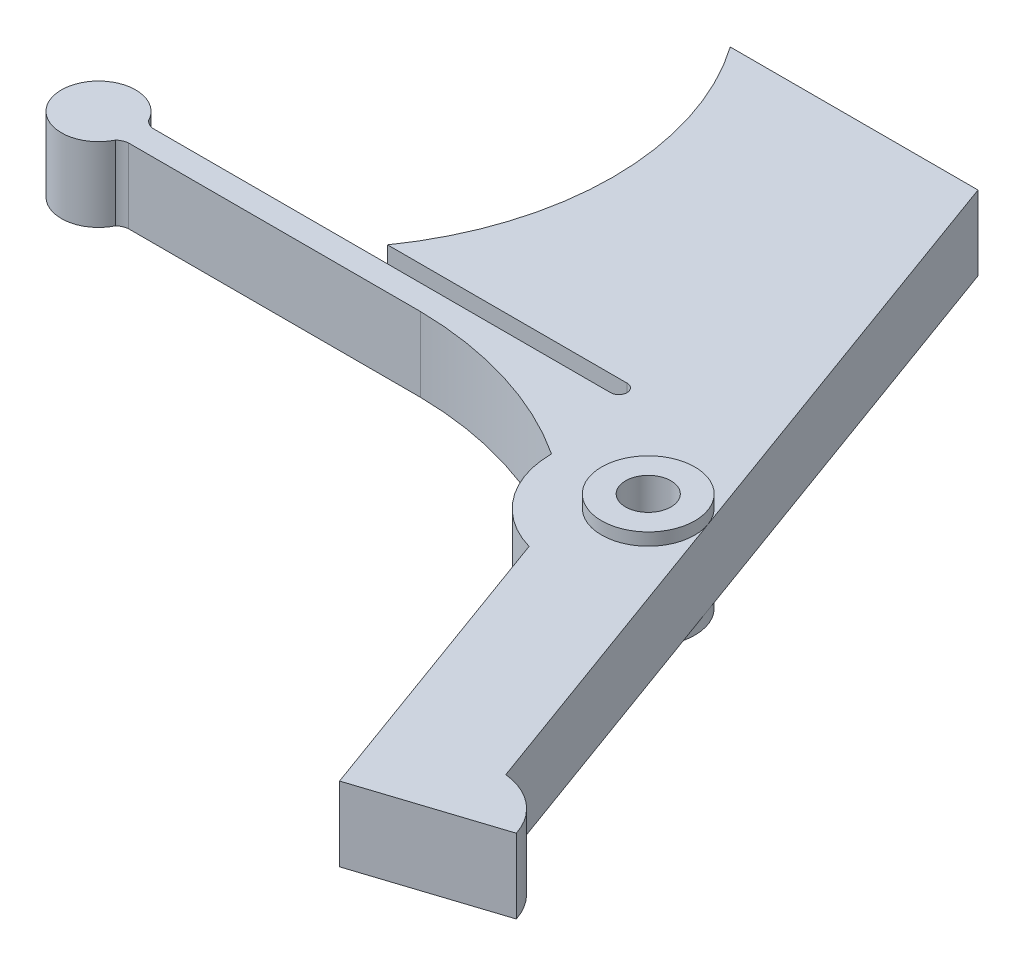
from build123d import *

# Parameters (mm, degrees)
BOSS_EXTRUDE1_DEPTH      = 4.572
BOSS_EXTRUDE2_DEPTH      = 0.762
BOSS_EXTRUDE2_DEPTH_BACK = 5.334
SKETCH2_R                = 2.869299529
SKETCH3_R                = 1.397
CUT_EXTRUDE1_DEPTH       = 44.588683524


with BuildPart() as part:
    # Sketch1 → Boss-Extrude1 (new body)
    with BuildSketch(Plane(origin=(0, 0, 0), x_dir=(1, 0, 0), z_dir=(0, 1, 0))):
        with BuildLine():
            Line((0, 23.945183489), (16.621899459, -21.723109944))
            ThreePointArc((16.621899459, -21.723109944), (18.758742816, -22.611950557), (20.0669487, -24.521069341))
            Line((20.0669487, -24.521069341), (11.850067084, -27.178766186))
            Line((11.850067084, -27.178766186), (5.178997556, -8.850153293))
            ThreePointArc((5.178997556, -8.850153293), (2.119691783, -6.751008186), (0.941519753, -3.232816511))
            ThreePointArc((0.941519753, -3.232816511), (-4.609142435, -0.625246171), (-10.668, 0.323183489))
            Line((-10.668, 0.323183489), (-28.650367288, 0.323183489))
            ThreePointArc((-28.650367288, 0.323183489), (-28.941106082, 0.241834206), (-29.19191304, 0.073778793))
            ThreePointArc((-29.19191304, 0.073778793), (-33.527942998, 1.06904003), (-29.206401998, 2.125441522))
            ThreePointArc((-29.206401998, 2.125441522), (-28.965026953, 1.944099747), (-28.679100404, 1.847183489))
            Line((-28.679100404, 1.847183489), (-0.508, 1.847183489))
            ThreePointArc((-0.508, 1.847183489), (0, 2.355183489), (-0.508, 2.863183489))
            Line((-0.508, 2.863183489), (-15.24, 2.863183489))
            ThreePointArc((-15.24, 2.863183489), (-11.9126, 13.404183489), (-15.24, 23.945183489))
            Line((-15.24, 23.945183489), (0, 23.945183489))
        make_face()
    extrude(amount=BOSS_EXTRUDE1_DEPTH)

    # Sketch2 → Boss-Extrude2 (add, two sides: drawn at the far end of the back side and taken through both)
    with BuildSketch(Plane(origin=(0, 4.572, 0), x_dir=(1, 0, 0), z_dir=(0, 1, 0)).offset(-BOSS_EXTRUDE2_DEPTH_BACK)):
        with Locations(Location((6.807711808, -3.148121568, 0), (0, 0, 270))):
            Circle(SKETCH2_R)
    extrude(amount=BOSS_EXTRUDE2_DEPTH + BOSS_EXTRUDE2_DEPTH_BACK)

    # Sketch3 → Cut-Extrude1 (cut, through all)
    with BuildSketch(Plane(origin=(0, 5.334, 0), x_dir=(1, 0, 0), z_dir=(0, 1, 0))):
        with Locations(Location((6.807711808, -3.148121568, 0), (0, 0, 270))):
            Circle(SKETCH3_R)
    extrude(amount=-CUT_EXTRUDE1_DEPTH, mode=Mode.SUBTRACT)


solid = part.part
